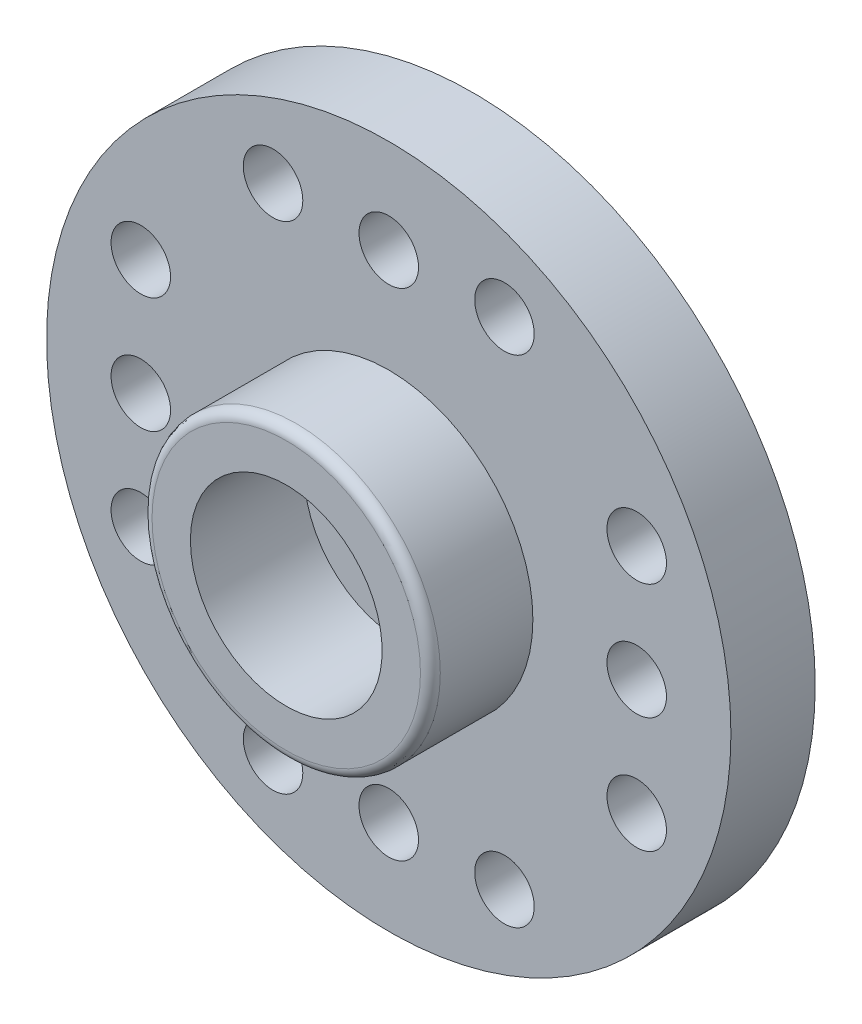
from build123d import *

# Parameters (mm, degrees)
ESBO_O1_R                  = 10.35
RESSALTO_EXTRUS_O1_DEPTH   = 2.55
ESBO_O2_R                  = 4.36
ESBO_O2_R_2                = 2.9
RESSALTO_EXTRUS_O2_DEPTH   = 3.1
RESSALTO_EXTRUS_O3_START   = 0.49
ESBO_O3_R                  = 4.36
RESSALTO_EXTRUS_O3_DEPTH   = 0.49
CHANFRO1_SIZE              = 0.48
ESBO_O4_R                  = 3.5
CORTE_EXTRUS_O1_DEPTH      = 1.2
CORTE_EXTRUS_O2_DEPTH      = 7
CORTE_EXTRUS_O2_DEPTH_BACK = 7.2
ESBO_O5_R                  = 1.25
FILETE1_R                  = 0.3
CORTE_EXTRUS_O3_DEPTH      = 2
CORTE_EXTRUS_O3_DEPTH_BACK = 4.2
ESBO_O6_R                  = 0.9
CORTE_EXTRUS_O4_START      = -3.45
ESBO_O8_R                  = 2.9
CORTE_EXTRUS_O4_DEPTH      = 3.45


with BuildPart() as part:
    # Esboço1 → Ressalto-extrusão1 (new body)
    with BuildSketch(Plane.XY):
        Circle(ESBO_O1_R)
    extrude(amount=RESSALTO_EXTRUS_O1_DEPTH)

    # Esboço2 → Ressalto-extrusão2 (add)
    with BuildSketch(Plane.XY.offset(2.55)):
        with Locations(Location((0, 0, 0), (0, 0, 180))):
            Circle(ESBO_O2_R)
        with Locations(Location((0, 0, 0), (0, 0, 180))):
            Circle(ESBO_O2_R_2, mode=Mode.SUBTRACT)
    extrude(amount=RESSALTO_EXTRUS_O2_DEPTH)

    # Esboço3 → Ressalto-extrusão3 (add)
    with BuildSketch(Plane(origin=(0, 0, 0), x_dir=(-1, 0, 0), z_dir=(0, 0, -1)).offset(RESSALTO_EXTRUS_O3_START)):
        Circle(ESBO_O3_R)
    extrude(amount=-RESSALTO_EXTRUS_O3_DEPTH)

    # Chanfro1
    chanfro1_edges = [part.edges().sort_by_distance(p)[0] for p in [
        (4.36, 0, -0.49),
    ]]
    chamfer(chanfro1_edges, length=CHANFRO1_SIZE)

    # Esboço4 → Corte-extrusão1 (cut)
    with BuildSketch(Plane(origin=(0, 0, -0.49), x_dir=(-1, 0, 0), z_dir=(0, 0, -1))):
        Circle(ESBO_O4_R)
    extrude(amount=-CORTE_EXTRUS_O1_DEPTH, mode=Mode.SUBTRACT)

    # Esboço5 → Corte-extrusão2 (cut, two sides: drawn at the far end of the back side and taken through both)
    with BuildSketch(Plane.XY.offset(2.55).offset(-CORTE_EXTRUS_O2_DEPTH_BACK)):
        with Locations(Location((0, 0, 0), (0, 0, 180))):
            Circle(ESBO_O5_R)
    extrude(amount=CORTE_EXTRUS_O2_DEPTH + CORTE_EXTRUS_O2_DEPTH_BACK, mode=Mode.SUBTRACT)

    # Filete1
    filete1_edges = [part.edges().sort_by_distance(p)[0] for p in [
        (4.36, 0, 5.65),
    ]]
    fillet(filete1_edges, radius=FILETE1_R)

    # Esboço6 → Corte-extrusão3 (cut, two sides: drawn at the far end of the back side and taken through both)
    with BuildSketch(Plane.XY.offset(2.55).offset(-CORTE_EXTRUS_O3_DEPTH_BACK)):
        with Locations((0, 7.5)):
            Circle(ESBO_O6_R)
        with Locations((-3.5, 7.5)):
            Circle(ESBO_O6_R)
        with Locations((3.5, 7.5)):
            Circle(ESBO_O6_R)
        with Locations((7.5, 0)):
            Circle(ESBO_O6_R)
        with Locations((7.5, 3.5)):
            Circle(ESBO_O6_R)
        with Locations((7.5, -3.5)):
            Circle(ESBO_O6_R)
        with Locations((-7.5, -3.5)):
            Circle(ESBO_O6_R)
        with Locations((-7.5, 3.5)):
            Circle(ESBO_O6_R)
        with Locations((-7.5, 0)):
            Circle(ESBO_O6_R)
        with Locations((3.5, -7.5)):
            Circle(ESBO_O6_R)
        with Locations((-3.5, -7.5)):
            Circle(ESBO_O6_R)
        with Locations((0, -7.5)):
            Circle(ESBO_O6_R)
    extrude(amount=CORTE_EXTRUS_O3_DEPTH + CORTE_EXTRUS_O3_DEPTH_BACK, mode=Mode.SUBTRACT)

    # Esboço8 → Corte-extrusão4 (cut)
    with BuildSketch(Plane.XY.offset(5.65).offset(CORTE_EXTRUS_O4_START)):
        with Locations(Location((0, 0, 0), (0, 0, 180))):
            Circle(ESBO_O8_R)
    extrude(amount=CORTE_EXTRUS_O4_DEPTH, mode=Mode.SUBTRACT)


solid = part.part
